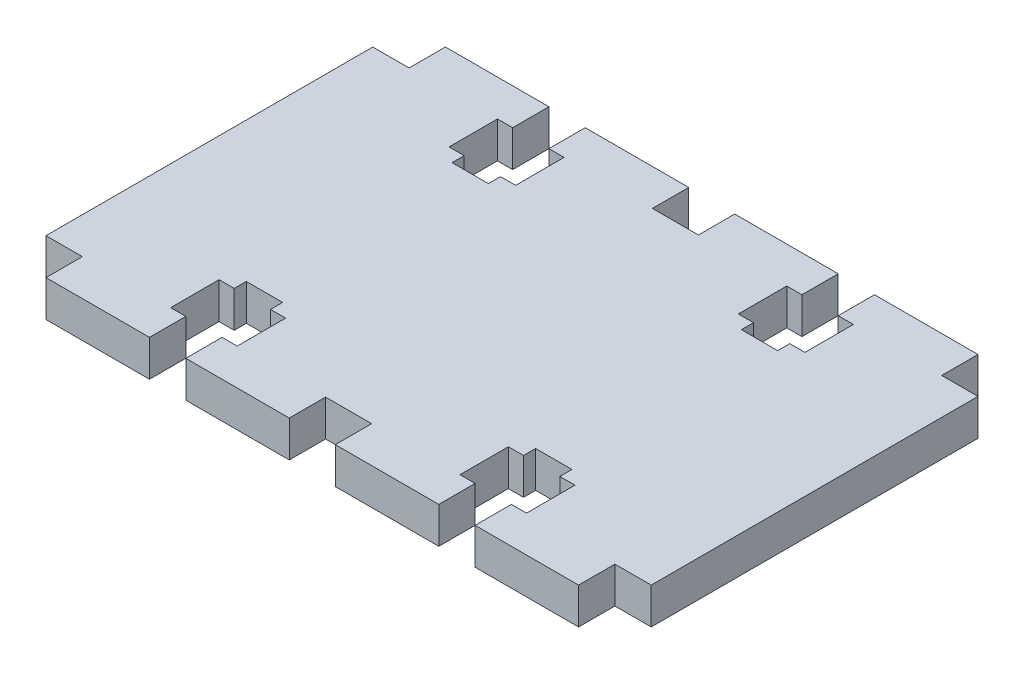
from build123d import *

# Parameters (mm, degrees)
EXTRUDE_1_DEPTH = 3


with BuildPart() as part:
    # 草图1 → 凸台-拉伸1 (new body)
    with BuildSketch(Plane(origin=(0, 0, 0), x_dir=(1, 0, 0), z_dir=(0, 1, 0))):
        Polygon((15.799055804, 0), (15.799055804, -4), (14.549055804, -4), (14.549055804, -5), (11.549055804, -5), (11.549055804, -4), (10.299055804, -4), (10.299055804, 0), (11.549055804, 0), (11.549055804, 3), (3, 3), (3, 0), (0, 0), (0, -27), (3, -27), (3, -30), (11.549055804, -30), (11.549055804, -27), (10.299055804, -27), (10.299055804, -23), (11.549055804, -23), (11.549055804, -22), (14.549055804, -22), (14.549055804, -23), (15.799055804, -23), (15.799055804, -27), (14.549055804, -27), (14.549055804, -30), (23.098111609, -30), (23.098111609, -27), (26.901888391, -27), (26.901888391, -30), (35.450944196, -30), (35.450944196, -27), (34.200944196, -27), (34.200944196, -23), (35.450944196, -23), (35.450944196, -22), (38.450944196, -22), (38.450944196, -23), (39.700944196, -23), (39.700944196, -27), (38.450944196, -27), (38.450944196, -30), (47, -30), (47, -27), (50, -27), (50, 0), (47, 0), (47, 3), (38.450944196, 3), (38.450944196, 0), (39.700944196, 0), (39.700944196, -4), (38.450944196, -4), (38.450944196, -5), (35.450944196, -5), (35.450944196, -4), (34.200944196, -4), (34.200944196, 0), (35.450944196, 0), (35.450944196, 3), (26.901888391, 3), (26.901888391, 0), (23.098111609, 0), (23.098111609, 3), (14.549055804, 3), (14.549055804, 0), align=None)
    extrude(amount=EXTRUDE_1_DEPTH)


solid = part.part
